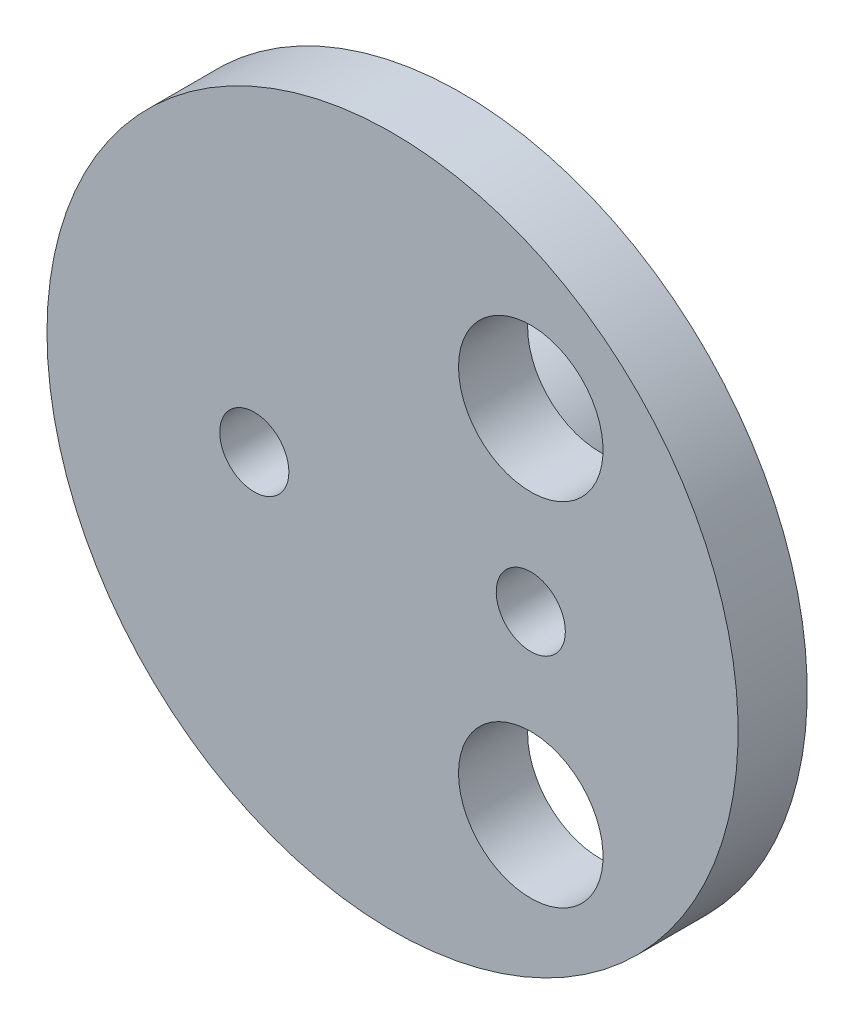
from build123d import *

# Parameters (mm, degrees)
ESQUISSE1_R             = 12.5
ESQUISSE1_R_2           = 1.25
ESQUISSE1_R_3           = 2.613961031
DISQUE_O25_DEPTH        = 2.5
ESQUISSE2_R             = 5
ESQUISSE2_R_2           = 2.9
MOYEU_CANNELE_25T_DEPTH = 3.5


with BuildPart() as part:
    # Esquisse1 → Disque O25 (new body)
    with BuildSketch(Plane.XY):
        Circle(ESQUISSE1_R)
        with Locations((5, 0)):
            Circle(ESQUISSE1_R_2, mode=Mode.SUBTRACT)
        with Locations((-5, 0)):
            Circle(ESQUISSE1_R_2, mode=Mode.SUBTRACT)
        with Locations((5, 6.363961031)):
            Circle(ESQUISSE1_R_3, mode=Mode.SUBTRACT)
        with Locations((5, -6.363961031)):
            Circle(ESQUISSE1_R_3, mode=Mode.SUBTRACT)
    extrude(amount=DISQUE_O25_DEPTH)

    # Esquisse2 → Moyeu cannele 25T (add)
    with BuildSketch(Plane.XY):
        Circle(ESQUISSE2_R)
        Circle(ESQUISSE2_R_2, mode=Mode.SUBTRACT)
    extrude(amount=-MOYEU_CANNELE_25T_DEPTH)


solid = part.part
